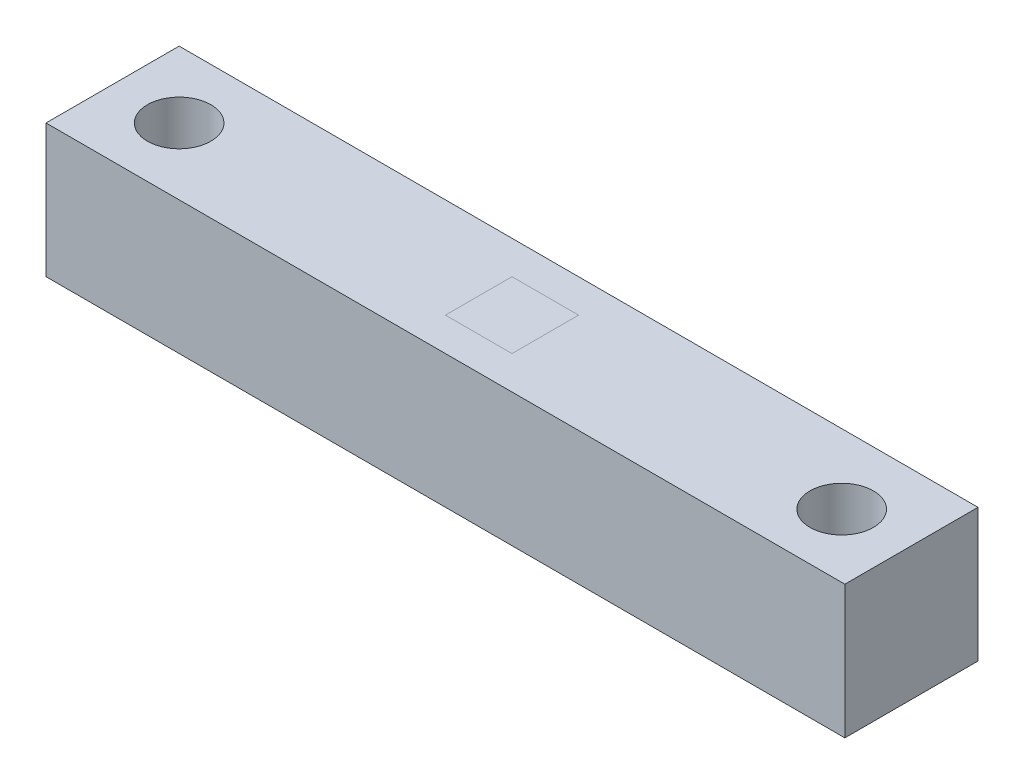
from build123d import *

# Parameters (mm, degrees)
SKETCH1_W           = 240
SKETCH1_H           = 40
BOSS_EXTRUDE1_DEPTH = 40
SKETCH3_R           = 9.525
CUT_EXTRUDE4_DEPTH  = 133.664991614


with BuildPart() as part:
    # Sketch1 → Boss-Extrude1 (new body)
    with BuildSketch(Plane.XY):
        Rectangle(SKETCH1_W, SKETCH1_H)
    extrude(amount=BOSS_EXTRUDE1_DEPTH)

    # Sketch3 → Cut-Extrude4 (cut, through all)
    with BuildSketch(Plane(origin=(0, 20, 0), x_dir=(1, 0, 0), z_dir=(0, 1, 0))):
        with Locations(Location((-100, -20, 0), (0, 0, 180))):
            Circle(SKETCH3_R)
        with Locations(Location((100, -20.95, 0), (0, 0, 180))):
            Circle(SKETCH3_R)
    extrude(amount=-CUT_EXTRUDE4_DEPTH, mode=Mode.SUBTRACT)


solid = part.part
